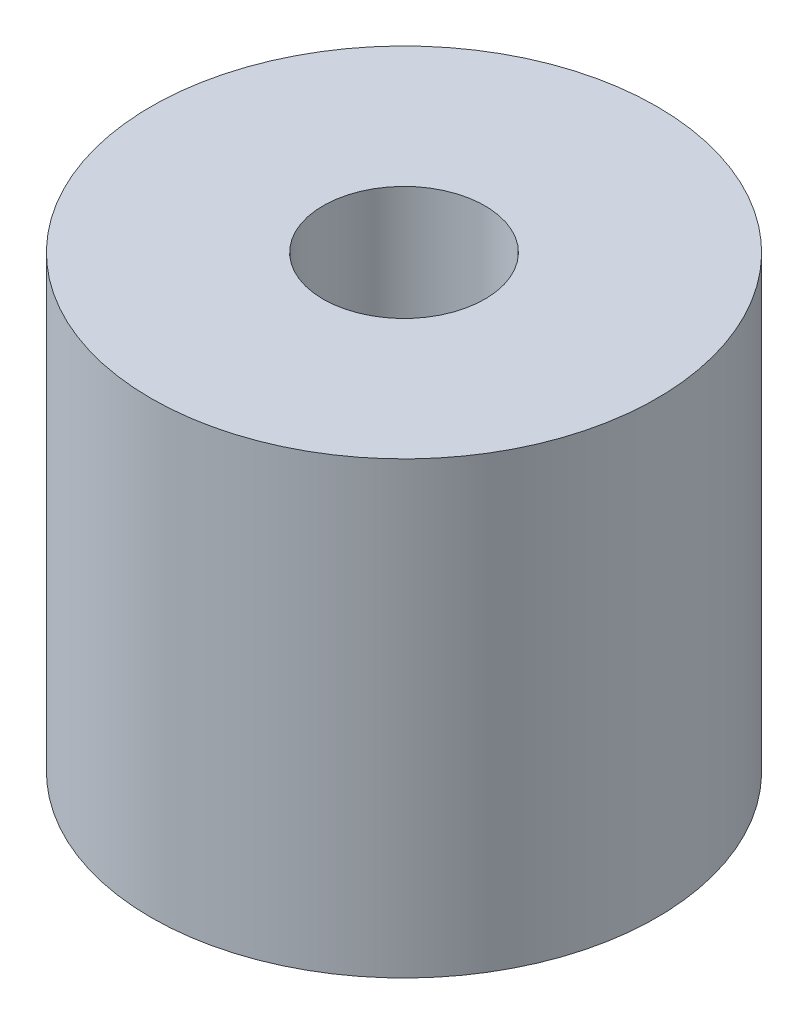
from build123d import *

# Parameters (mm, degrees)
SKETCH1_R           = 7.14375
SKETCH1_R_2         = 2.286
BOSS_EXTRUDE1_DEPTH = 12.7


with BuildPart() as part:
    # Sketch1 → Boss-Extrude1 (new body)
    with BuildSketch(Plane(origin=(0, 0, 0), x_dir=(1, 0, 0), z_dir=(0, 1, 0))):
        with Locations(Location((0, 0, 0), (0, 0, 270))):
            Circle(SKETCH1_R)
        with Locations(Location((0, 0, 0), (0, 0, 270))):
            Circle(SKETCH1_R_2, mode=Mode.SUBTRACT)
    extrude(amount=BOSS_EXTRUDE1_DEPTH)


solid = part.part
